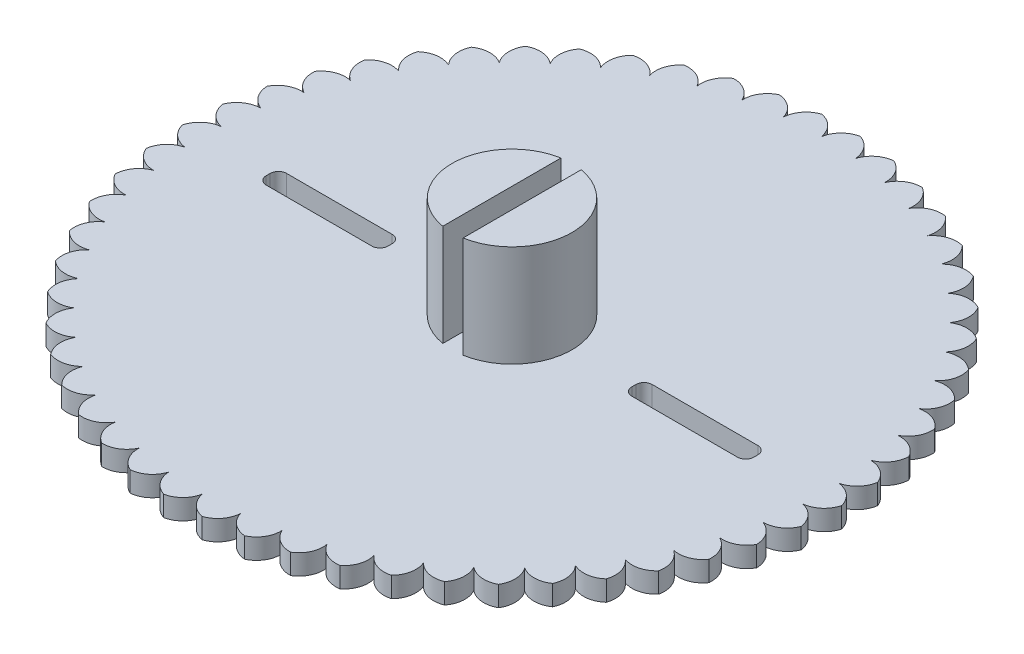
from build123d import *

# Parameters (mm, degrees)
SKETCH1_R           = 81.2
BOSS_EXTRUDE1_DEPTH = 5
SKETCH4_R           = 14.75
BOSS_EXTRUDE2_DEPTH = 25
CUT_EXTRUDE2_DEPTH  = 118.523955005
CIRPATTERN2_COUNT   = 54
CUT_EXTRUDE4_DEPTH  = 118.337042358
SKETCH5_W           = 5
SKETCH5_H           = 29.5
CUT_EXTRUDE3_DEPTH  = 25
LPATTERN1_COUNT     = 2
LPATTERN1_PITCH     = 90


with BuildPart() as part:
    # Sketch1 → Boss-Extrude1 (new body)
    with BuildSketch(Plane(origin=(0, 0, 0), x_dir=(1, 0, 0), z_dir=(0, 1, 0))):
        with Locations(Location((0, 0, 0), (0, 0, 270))):
            Circle(SKETCH1_R)
    extrude(amount=BOSS_EXTRUDE1_DEPTH)

    # Sketch4 → Boss-Extrude2 (add)
    with BuildSketch(Plane(origin=(0, 5, 0), x_dir=(1, 0, 0), z_dir=(0, 1, 0))):
        with Locations(Location((0, 0, 0), (0, 0, 270))):
            Circle(SKETCH4_R)
    extrude(amount=BOSS_EXTRUDE2_DEPTH)

    # Sketch2 → Cut-Extrude2 (cut, through all)
    with BuildSketch(Plane(origin=(0, 5, 0), x_dir=(1, 0, 0), z_dir=(0, 1, 0))):
        with BuildLine():
            ThreePointArc((5, 81.045912914), (0, 81.2), (-5, 81.045912914))
            ThreePointArc((-5, 81.045912914), (-1.725153292, 79.42244122), (0, 76.2))
            ThreePointArc((0, 76.2), (1.725153292, 79.42244122), (5, 81.045912914))
        make_face()
    cut_extrude2 = extrude(amount=-CUT_EXTRUDE2_DEPTH, mode=Mode.SUBTRACT)

    # CirPattern2: Cut-Extrude2 ×54 about axis
    cirpattern2_axis = Axis((0, 0, 0), (0, 1, 0))
    for i in range(1, CIRPATTERN2_COUNT):
        add(cut_extrude2.rotate(cirpattern2_axis, i * 360 / CIRPATTERN2_COUNT), mode=Mode.SUBTRACT)

    # Sketch6 → Cut-Extrude4 (cut, through all)
    with BuildSketch(Plane(origin=(0, 5, 0), x_dir=(1, 0, 0), z_dir=(0, 1, 0))):
        with BuildLine():
            Line((-58, -2.5), (-32, -2.5))
            ThreePointArc((-32, -2.5), (-30.585786438, -1.914213562), (-30, -0.5))
            Line((-30, -0.5), (-30, 0.5))
            ThreePointArc((-30, 0.5), (-30.585786438, 1.914213562), (-32, 2.5))
            Line((-32, 2.5), (-58, 2.5))
            ThreePointArc((-58, 2.5), (-59.414213562, 1.914213562), (-60, 0.5))
            Line((-60, 0.5), (-60, -0.5))
            ThreePointArc((-60, -0.5), (-59.414213562, -1.914213562), (-58, -2.5))
        make_face()
    cut_extrude4 = extrude(amount=-CUT_EXTRUDE4_DEPTH, mode=Mode.SUBTRACT)

    # Sketch5 → Cut-Extrude3 (cut)
    with BuildSketch(Plane(origin=(0, 30, 0), x_dir=(1, 0, 0), z_dir=(0, 1, 0))):
        Rectangle(SKETCH5_W, SKETCH5_H)
    extrude(amount=-CUT_EXTRUDE3_DEPTH, mode=Mode.SUBTRACT)

    # LPattern1: Cut-Extrude4 ×2
    with Locations(*[(i * LPATTERN1_PITCH, 0, 0) for i in range(1, LPATTERN1_COUNT)]):
        add(cut_extrude4, mode=Mode.SUBTRACT)


solid = part.part
